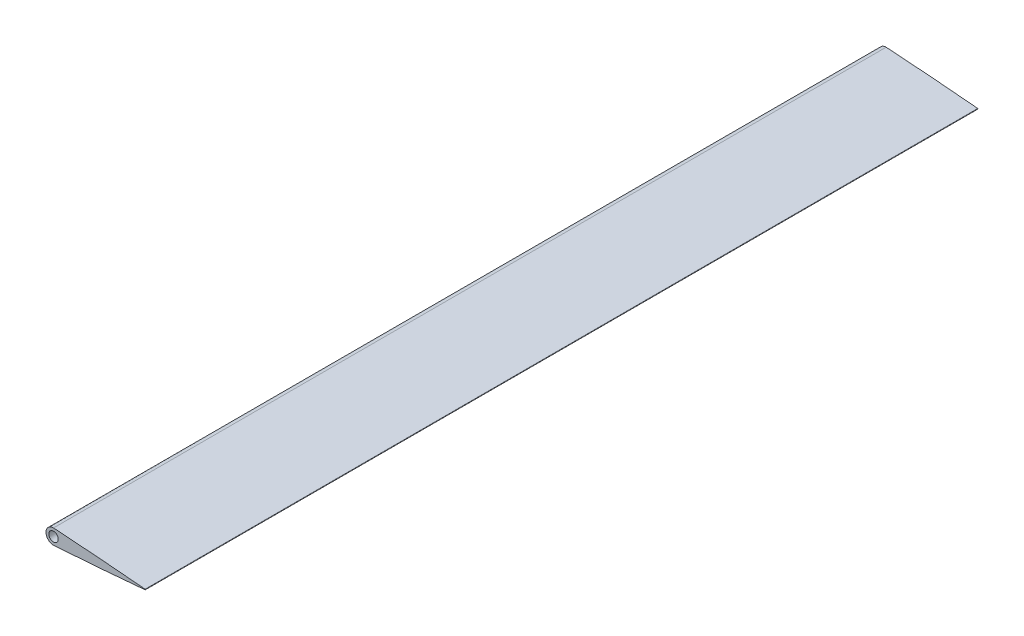
from build123d import *

# Parameters (mm, degrees)
FOAMEQUILIBRATORE_DEPTH = 263.67
SCHIZZO2_R              = 1.5
FOROPERNO_DEPTH         = 283.036042422


with BuildPart() as part:
    # Schizzo1 → FoamEquilibratore (new body)
    with BuildSketch(Plane.XY):
        with BuildLine():
            ThreePointArc((100, 0.084), (100.083999999, -1e-09), (99.999999999, -0.084))
            add(Edge.make_bspline(
                [(70.999999999, -2.377645078), (74.000829104, -2.180171911), (80.336320928, -1.737523123), (88.33555962, -1.11089898), (95.001194724, -0.542172689), (98.333488814, -0.23674648), (99.999999999, -0.084)],
                knots=[0.855853291, 0.855853291, 0.855853291, 0.855853291, 0.900556598, 0.950258285, 0.975123707, 1, 1, 1, 1], degree=3))
            ThreePointArc((70.999999999, -2.377645078), (68.622354921, 0), (70.999999999, 2.377645078))
            add(Edge.make_bspline(
                [(100, 0.084), (98.333488815, 0.23674648), (95.001194725, 0.542172689), (88.335559621, 1.11089898), (80.336320928, 1.737523123), (74.000829105, 2.180171911), (70.999999999, 2.377645078)],
                knots=[0, 0, 0, 0, 0.024876293, 0.049741715, 0.099443402, 0.144146709, 0.144146709, 0.144146709, 0.144146709], degree=3))
        make_face()
    extrude(amount=FOAMEQUILIBRATORE_DEPTH)

    # Schizzo2 → ForoPerno (cut, through all)
    with BuildSketch(Plane.XY.offset(263.67)):
        with Locations((70.999999999, 0)):
            Circle(SCHIZZO2_R)
    extrude(amount=-FOROPERNO_DEPTH, mode=Mode.SUBTRACT)


solid = part.part
